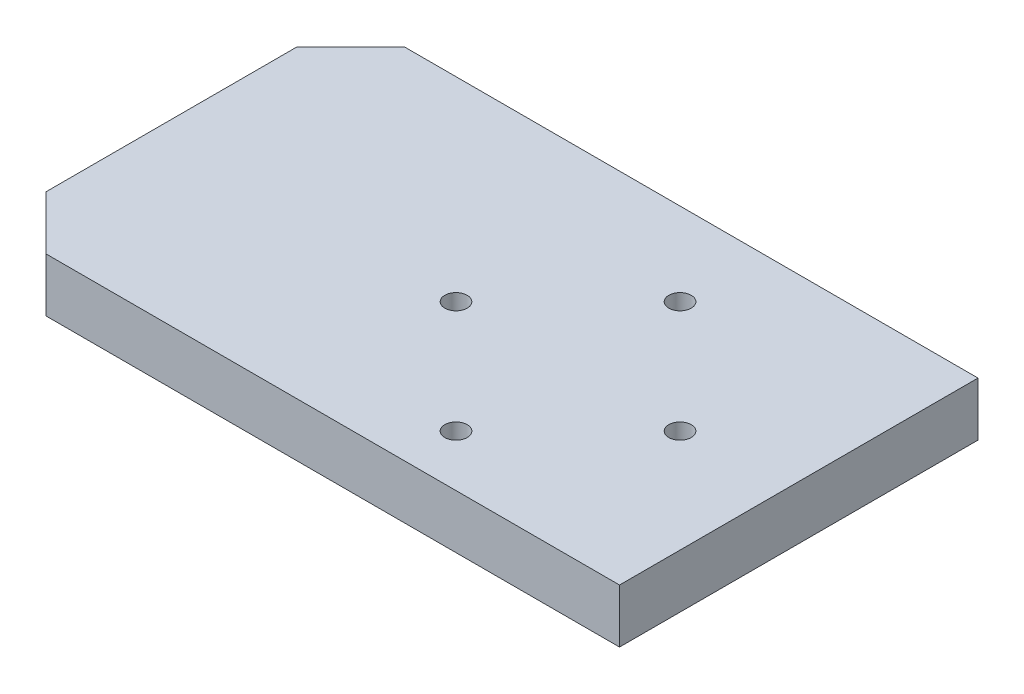
from build123d import *

# Parameters (mm, degrees)
SKETCH1_R           = 2.5
BOSS_EXTRUDE1_DEPTH = 12


with BuildPart() as part:
    # Sketch1 → Boss-Extrude1 (new body)
    with BuildSketch(Plane(origin=(0, 0, 0), x_dir=(1, 0, 0), z_dir=(0, 1, 0))):
        Polygon((-58, -40), (-70, -28), (-70, 28), (-58, 40), (70, 40), (70, -40), align=None)
        with Locations(Location((22, 21.5, 0), (0, 0, 270))):
            Circle(SKETCH1_R, mode=Mode.SUBTRACT)
        with Locations(Location((47, -3.5, 0), (0, 0, 270))):
            Circle(SKETCH1_R, mode=Mode.SUBTRACT)
        with Locations(Location((22, -28.5, 0), (0, 0, 270))):
            Circle(SKETCH1_R, mode=Mode.SUBTRACT)
        with Locations(Location((-3, -3.5, 0), (0, 0, 270))):
            Circle(SKETCH1_R, mode=Mode.SUBTRACT)
    extrude(amount=BOSS_EXTRUDE1_DEPTH)


solid = part.part
